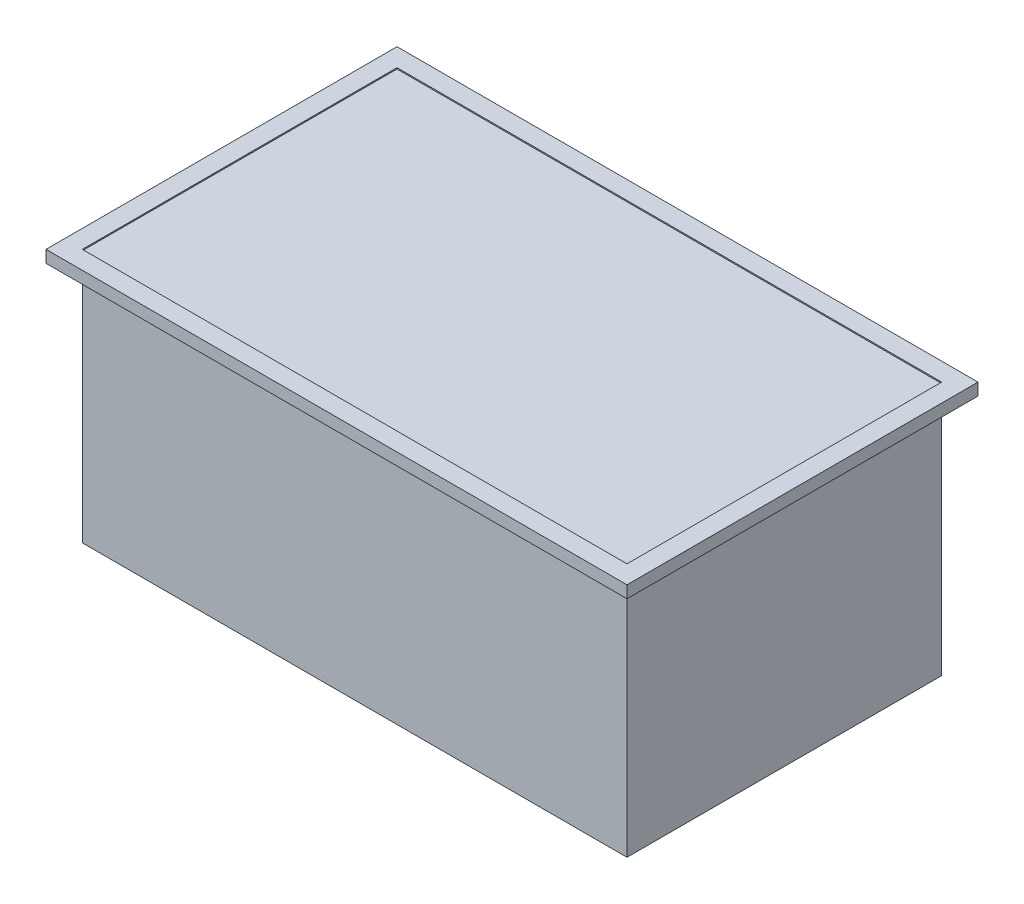
from build123d import *

# Parameters (mm, degrees)
SKETCH_1_W          = 45
SKETCH_1_H          = 26
EXTRUDE_4_DEPTH     = 20
SKETCH_3_W          = 48
SKETCH_3_H          = 29
EXTRUDE_5_DEPTH     = 1
SKETCH_4_W          = 45
SKETCH_4_H          = 26
CUT_EXTRUDE_1_DEPTH = 0.1


with BuildPart() as part:
    # 草图1 → 凸台-拉伸4 (new body)
    with BuildSketch(Plane(origin=(0, 0, 0), x_dir=(1, 0, 0), z_dir=(0, 1, 0))):
        Rectangle(SKETCH_1_W, SKETCH_1_H)
    extrude(amount=EXTRUDE_4_DEPTH)

    # 草图3 → 凸台-拉伸5 (add)
    with BuildSketch(Plane(origin=(0, 20, 0), x_dir=(1, 0, 0), z_dir=(0, 1, 0))):
        Rectangle(SKETCH_3_W, SKETCH_3_H)
    extrude(amount=EXTRUDE_5_DEPTH)

    # 草图4 → 切除-拉伸1 (cut)
    with BuildSketch(Plane(origin=(0, 21, 0), x_dir=(1, 0, 0), z_dir=(0, 1, 0))):
        Rectangle(SKETCH_4_W, SKETCH_4_H)
    extrude(amount=-CUT_EXTRUDE_1_DEPTH, mode=Mode.SUBTRACT)


solid = part.part
